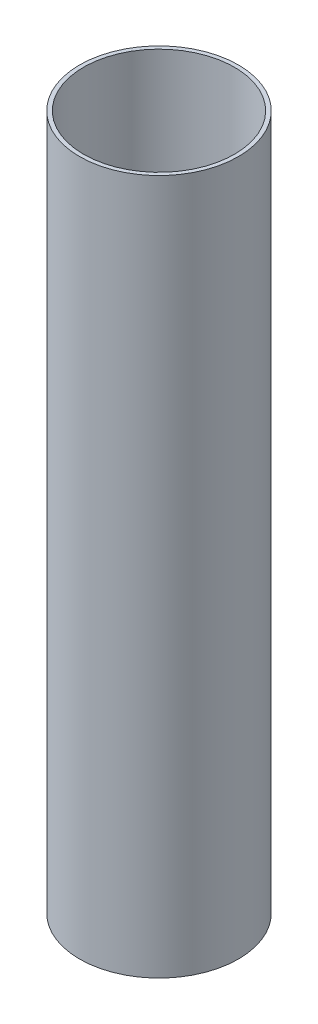
from build123d import *

# Parameters (mm, degrees)
SKETCH1_R           = 40
SKETCH1_R_2         = 38
BOSS_EXTRUDE1_DEPTH = 350


with BuildPart() as part:
    # Sketch1 → Boss-Extrude1 (new body)
    with BuildSketch(Plane(origin=(0, 0, 0), x_dir=(1, 0, 0), z_dir=(0, 1, 0))):
        with Locations(Location((0, 0, 0), (0, 0, 270))):
            Circle(SKETCH1_R)
        with Locations(Location((0, 0, 0), (0, 0, 270))):
            Circle(SKETCH1_R_2, mode=Mode.SUBTRACT)
    extrude(amount=BOSS_EXTRUDE1_DEPTH)


solid = part.part
